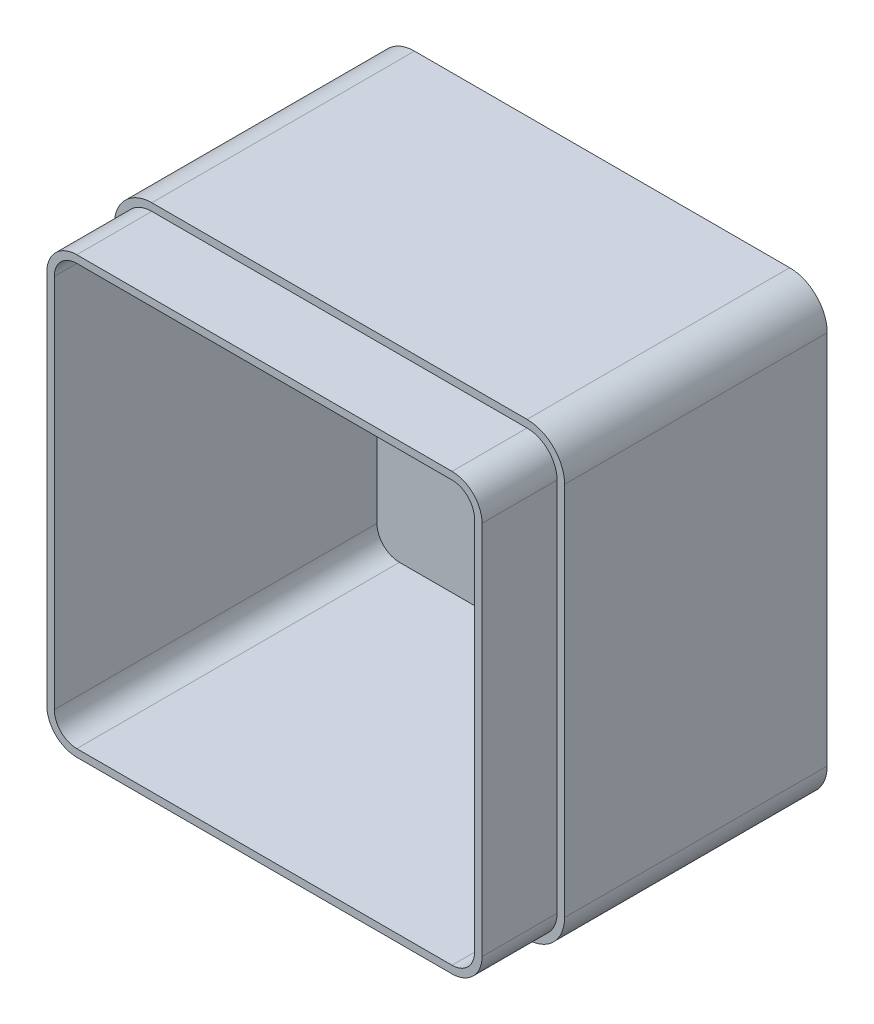
from build123d import *

# Parameters (mm, degrees)
SKETCH1_W           = 120
SKETCH1_H           = 120
BOSS_EXTRUDE1_DEPTH = 90
FILLET1_R           = 10
SHELL1_T            = -4
CUT_EXTRUDE7_DEPTH  = 20


with BuildPart() as part:
    # Sketch1 → Boss-Extrude1 (new body)
    with BuildSketch(Plane.XY):
        with Locations((60, -60)):
            Rectangle(SKETCH1_W, SKETCH1_H)
    extrude(amount=BOSS_EXTRUDE1_DEPTH)

    # Fillet1
    fillet1_edges = [part.edges().sort_by_distance(p)[0] for p in [
        (0, 0, 45),
        (120, 0, 45),
        (120, -120, 45),
        (0, -120, 45),
    ]]
    fillet(fillet1_edges, radius=FILLET1_R)

    # Shell1
    shell1_openings = [part.faces().sort_by_distance(p)[0] for p in [
        (60, -60, 90),
    ]]
    offset(amount=SHELL1_T, openings=shell1_openings, kind=Kind.INTERSECTION)

    # Sketch4 → Cut-Extrude7 (cut)
    with BuildSketch(Plane.XY.offset(90)):
        with BuildLine():
            Line((0, -10), (0, -110))
            ThreePointArc((0, -110), (2.928932188, -117.071067812), (10, -120))
            Line((10, -120), (110, -120))
            ThreePointArc((110, -120), (117.071067812, -117.071067812), (120, -110))
            Line((120, -110), (120, -10))
            ThreePointArc((120, -10), (117.071067812, -2.928932188), (110, 0))
            Line((110, 0), (10, 0))
            ThreePointArc((10, 0), (2.928932188, -2.928932188), (0, -10))
        make_face()
        with BuildLine():
            Line((2, -10), (2, -110))
            ThreePointArc((2, -110), (4.343145751, -115.656854249), (10, -118))
            Line((10, -118), (110, -118))
            ThreePointArc((110, -118), (115.656854249, -115.656854249), (118, -110))
            Line((118, -110), (118, -10))
            ThreePointArc((118, -10), (115.656854249, -4.343145751), (110, -2))
            Line((110, -2), (10, -2))
            ThreePointArc((10, -2), (4.343145751, -4.343145751), (2, -10))
        make_face(mode=Mode.SUBTRACT)
    extrude(amount=-CUT_EXTRUDE7_DEPTH, mode=Mode.SUBTRACT)


solid = part.part
